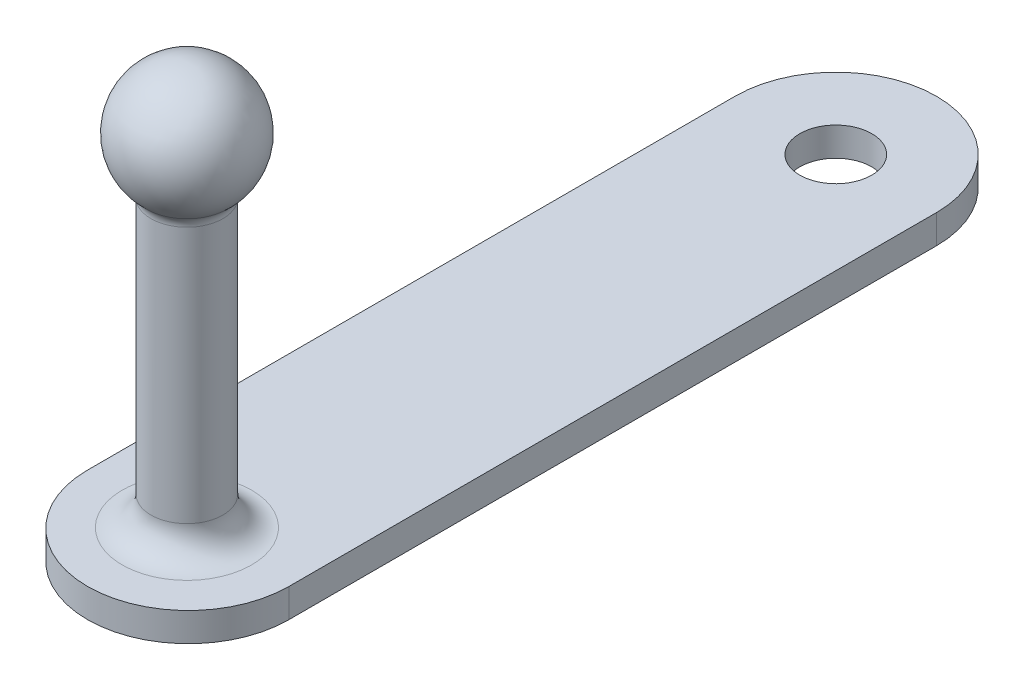
from build123d import *

# Parameters (mm, degrees)
SKETCH4_R           = 2.5
BOSS_EXTRUDE1_DEPTH = 2
FILLET1_R           = 2
FILLET2_R           = 1


with BuildPart() as part:
    # Sketch3 → Revolve1 (revolve)
    with BuildSketch(Plane.XY, mode=Mode.PRIVATE) as revolve1_sk:
        with BuildLine():
            Line((0, 0), (0, 22.313068229))
            ThreePointArc((0, 22.313068229), (-1.541624675, 27.064446646), (2.5, 30))
            Line((2.5, 30), (2.5, 0))
            Line((2.5, 0), (0, 0))
        make_face()
    revolve(revolve1_sk.sketch.rotate(Axis((2.5, 0, 0), (0, 1, 0)), 180), axis=Axis((2.5, 0, 0), (0, 1, 0)))

    # Sketch4 → Boss-Extrude1 (add)
    with BuildSketch(Plane.XZ):
        with BuildLine():
            Line((9.589249496, 0), (9.589249496, -45))
            ThreePointArc((9.589249496, -45), (2.589249496, -52), (-4.410750504, -45))
            Line((-4.410750504, -45), (-4.410750504, 0))
            ThreePointArc((-4.410750504, 0), (2.589249496, 7), (9.589249496, 0))
        make_face()
        with Locations(Location((2.589249496, -45, 0), (0, 0, 270))):
            Circle(SKETCH4_R, mode=Mode.SUBTRACT)
    extrude(amount=-BOSS_EXTRUDE1_DEPTH)

    # Fillet1
    fillet1_edges = [part.edges().sort_by_distance(p)[0] for p in [
        (0, 2, 0),
    ]]
    fillet(fillet1_edges, radius=FILLET1_R)

    # Fillet2
    fillet2_edges = [part.edges().sort_by_distance(p)[0] for p in [
        (0, 22.313068229, 0),
    ]]
    fillet(fillet2_edges, radius=FILLET2_R)


solid = part.part
